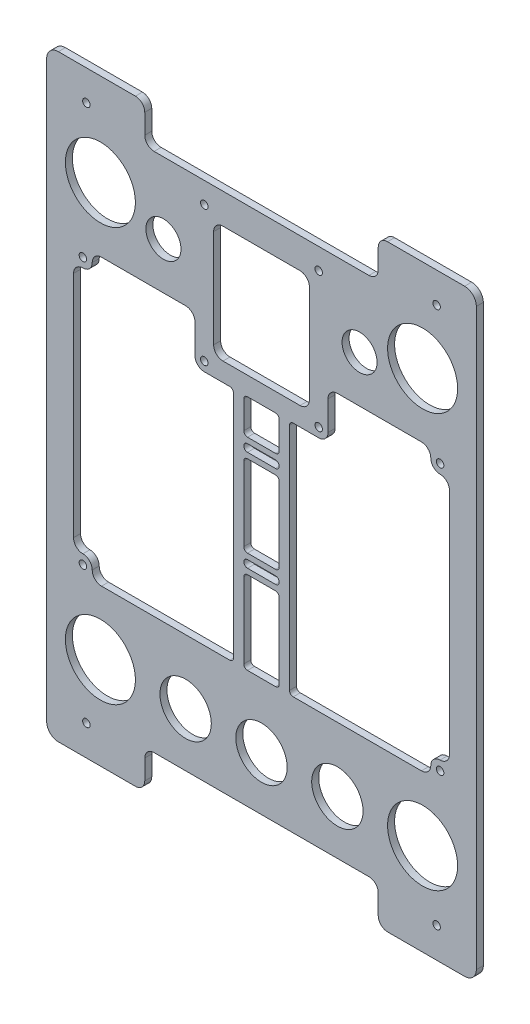
from build123d import *

# Parameters (mm, degrees)
MODEL_R             = 1.6
MODEL_R_2           = 15
MODEL_R_3           = 11
MODEL_R_4           = 7.5
BOSS_EXTRUDE1_DEPTH = 1.5


with BuildPart() as part:
    # Model → Boss-Extrude1 (new, symmetric)
    with BuildSketch(Plane.XY):
        with BuildLine():
            Line((-87, -128), (-54, -128))
            ThreePointArc((-54, -128), (-51.171572875, -126.828427125), (-50, -124))
            Line((-50, -124), (-50, -115.5))
            ThreePointArc((-50, -115.5), (-48.828427125, -112.671572875), (-46, -111.5))
            Line((-46, -111.5), (46, -111.5))
            ThreePointArc((46, -111.5), (48.828427125, -112.671572875), (50, -115.5))
            Line((50, -115.5), (50, -124))
            ThreePointArc((50, -124), (51.171572875, -126.828427125), (54, -128))
            Line((54, -128), (87, -128))
            ThreePointArc((87, -128), (90.535533906, -126.535533906), (92, -123))
            Line((92, -123), (92, 123))
            ThreePointArc((92, 123), (90.535533906, 126.535533906), (87, 128))
            Line((87, 128), (54, 128))
            ThreePointArc((54, 128), (51.171572875, 126.828427125), (50, 124))
            Line((50, 124), (50, 115.5))
            ThreePointArc((50, 115.5), (48.828427125, 112.671572875), (46, 111.5))
            Line((46, 111.5), (-46, 111.5))
            ThreePointArc((-46, 111.5), (-48.828427125, 112.671572875), (-50, 115.5))
            Line((-50, 115.5), (-50, 124))
            ThreePointArc((-50, 124), (-51.171572875, 126.828427125), (-54, 128))
            Line((-54, 128), (-87, 128))
            ThreePointArc((-87, 128), (-90.535533906, 126.535533906), (-92, 123))
            Line((-92, 123), (-92, -123))
            ThreePointArc((-92, -123), (-90.535533906, -126.535533906), (-87, -128))
        make_face()
        with Locations((-75, 115)):
            Circle(MODEL_R, mode=Mode.SUBTRACT)
        with Locations((75, 115)):
            Circle(MODEL_R, mode=Mode.SUBTRACT)
        with Locations((-75, -115)):
            Circle(MODEL_R, mode=Mode.SUBTRACT)
        with Locations((75, -115)):
            Circle(MODEL_R, mode=Mode.SUBTRACT)
        with Locations((-69, 88.5)):
            Circle(MODEL_R_2, mode=Mode.SUBTRACT)
        with Locations((69, 88.5)):
            Circle(MODEL_R_2, mode=Mode.SUBTRACT)
        with Locations((-69, -88.5)):
            Circle(MODEL_R_2, mode=Mode.SUBTRACT)
        with Locations((69, -88.5)):
            Circle(MODEL_R_2, mode=Mode.SUBTRACT)
        with Locations((-24.5, 44.5)):
            Circle(MODEL_R, mode=Mode.SUBTRACT)
        with Locations((24.5, 44.5)):
            Circle(MODEL_R, mode=Mode.SUBTRACT)
        with Locations((-24.5, 102.5)):
            Circle(MODEL_R, mode=Mode.SUBTRACT)
        with Locations((24.5, 102.5)):
            Circle(MODEL_R, mode=Mode.SUBTRACT)
        with Locations((0, -88.5)):
            Circle(MODEL_R_3, mode=Mode.SUBTRACT)
        with Locations((-76.5, -57)):
            Circle(MODEL_R, mode=Mode.SUBTRACT)
        with Locations((-76.5, 57)):
            Circle(MODEL_R, mode=Mode.SUBTRACT)
        with Locations((76.5, -57)):
            Circle(MODEL_R, mode=Mode.SUBTRACT)
        with Locations((76.5, 57)):
            Circle(MODEL_R, mode=Mode.SUBTRACT)
        with Locations((-32.5, -88.5)):
            Circle(MODEL_R_3, mode=Mode.SUBTRACT)
        with Locations((32.5, -88.5)):
            Circle(MODEL_R_3, mode=Mode.SUBTRACT)
        with Locations((-42, 81)):
            Circle(MODEL_R_4, mode=Mode.SUBTRACT)
        with Locations((42, 81)):
            Circle(MODEL_R_4, mode=Mode.SUBTRACT)
        with BuildLine():
            Line((-24.5, 40.5), (-13.6, 40.5))
            ThreePointArc((-13.6, 40.5), (-12.46862915, 40.03137085), (-12, 38.9))
            Line((-12, 38.9), (-12, -59.4))
            ThreePointArc((-12, -59.4), (-12.46862915, -60.53137085), (-13.6, -61))
            Line((-13.6, -61), (-68.5, -61))
            ThreePointArc((-68.5, -61), (-71.328427125, -59.828427125), (-72.5, -57))
            ThreePointArc((-72.5, -57), (-73.671572875, -54.171572875), (-76.5, -53))
            ThreePointArc((-76.5, -53), (-79.328427125, -51.828427125), (-80.5, -49))
            Line((-80.5, -49), (-80.5, 49))
            ThreePointArc((-80.5, 49), (-79.328427125, 51.828427125), (-76.5, 53))
            ThreePointArc((-76.5, 53), (-73.671572875, 54.171572875), (-72.5, 57))
            ThreePointArc((-72.5, 57), (-71.328427125, 59.828427125), (-68.5, 61))
            Line((-68.5, 61), (-32.5, 61))
            ThreePointArc((-32.5, 61), (-29.671572875, 59.828427125), (-28.5, 57))
            Line((-28.5, 57), (-28.5, 44.5))
            ThreePointArc((-28.5, 44.5), (-27.328427125, 41.671572875), (-24.5, 40.5))
        make_face(mode=Mode.SUBTRACT)
        with BuildLine():
            Line((28.5, 44.5), (28.5, 57))
            ThreePointArc((28.5, 57), (29.671572875, 59.828427125), (32.5, 61))
            Line((32.5, 61), (68.5, 61))
            ThreePointArc((68.5, 61), (71.328427125, 59.828427125), (72.5, 57))
            ThreePointArc((72.5, 57), (73.671572875, 54.171572875), (76.5, 53))
            ThreePointArc((76.5, 53), (79.328427125, 51.828427125), (80.5, 49))
            Line((80.5, 49), (80.5, -49))
            ThreePointArc((80.5, -49), (79.328427125, -51.828427125), (76.5, -53))
            ThreePointArc((76.5, -53), (73.671572875, -54.171572875), (72.5, -57))
            ThreePointArc((72.5, -57), (71.328427125, -59.828427125), (68.5, -61))
            Line((68.5, -61), (13.6, -61))
            ThreePointArc((13.6, -61), (12.46862915, -60.53137085), (12, -59.4))
            Line((12, -59.4), (12, 38.9))
            ThreePointArc((12, 38.9), (12.46862915, 40.03137085), (13.6, 40.5))
            Line((13.6, 40.5), (24.5, 40.5))
            ThreePointArc((24.5, 40.5), (27.328427125, 41.671572875), (28.5, 44.5))
        make_face(mode=Mode.SUBTRACT)
        with BuildLine():
            Line((-16.5, 48.5), (16.5, 48.5))
            ThreePointArc((16.5, 48.5), (19.328427125, 49.671572875), (20.5, 52.5))
            Line((20.5, 52.5), (20.5, 94.5))
            ThreePointArc((20.5, 94.5), (19.328427125, 97.328427125), (16.5, 98.5))
            Line((16.5, 98.5), (-16.5, 98.5))
            ThreePointArc((-16.5, 98.5), (-19.328427125, 97.328427125), (-20.5, 94.5))
            Line((-20.5, 94.5), (-20.5, 52.5))
            ThreePointArc((-20.5, 52.5), (-19.328427125, 49.671572875), (-16.5, 48.5))
        make_face(mode=Mode.SUBTRACT)
        with BuildLine():
            Line((-6, 23.1), (6, 23.1))
            ThreePointArc((6, 23.1), (7.6, 21.5), (6, 19.9))
            Line((6, 19.9), (-6, 19.9))
            ThreePointArc((-6, 19.9), (-7.6, 21.5), (-6, 23.1))
        make_face(mode=Mode.SUBTRACT)
        with BuildLine():
            Line((-6, -19.9), (6, -19.9))
            ThreePointArc((6, -19.9), (7.6, -21.5), (6, -23.1))
            Line((6, -23.1), (-6, -23.1))
            ThreePointArc((-6, -23.1), (-7.6, -21.5), (-6, -19.9))
        make_face(mode=Mode.SUBTRACT)
        with BuildLine():
            Line((-6, 17.5), (6, 17.5))
            ThreePointArc((6, 17.5), (7.13137085, 17.03137085), (7.6, 15.9))
            Line((7.6, 15.9), (7.6, -15.9))
            ThreePointArc((7.6, -15.9), (7.13137085, -17.03137085), (6, -17.5))
            Line((6, -17.5), (-6, -17.5))
            ThreePointArc((-6, -17.5), (-7.13137085, -17.03137085), (-7.6, -15.9))
            Line((-7.6, -15.9), (-7.6, 15.9))
            ThreePointArc((-7.6, 15.9), (-7.13137085, 17.03137085), (-6, 17.5))
        make_face(mode=Mode.SUBTRACT)
        with BuildLine():
            Line((-6, 25.5), (6, 25.5))
            ThreePointArc((6, 25.5), (7.13137085, 25.96862915), (7.6, 27.1))
            Line((7.6, 27.1), (7.6, 38.9))
            ThreePointArc((7.6, 38.9), (7.13137085, 40.03137085), (6, 40.5))
            Line((6, 40.5), (-6, 40.5))
            ThreePointArc((-6, 40.5), (-7.13137085, 40.03137085), (-7.6, 38.9))
            Line((-7.6, 38.9), (-7.6, 27.1))
            ThreePointArc((-7.6, 27.1), (-7.13137085, 25.96862915), (-6, 25.5))
        make_face(mode=Mode.SUBTRACT)
        with BuildLine():
            Line((-6, -25.5), (6, -25.5))
            ThreePointArc((6, -25.5), (7.13137085, -25.96862915), (7.6, -27.1))
            Line((7.6, -27.1), (7.6, -59.4))
            ThreePointArc((7.6, -59.4), (7.13137085, -60.53137085), (6, -61))
            Line((6, -61), (-6, -61))
            ThreePointArc((-6, -61), (-7.13137085, -60.53137085), (-7.6, -59.4))
            Line((-7.6, -59.4), (-7.6, -27.1))
            ThreePointArc((-7.6, -27.1), (-7.13137085, -25.96862915), (-6, -25.5))
        make_face(mode=Mode.SUBTRACT)
    extrude(amount=BOSS_EXTRUDE1_DEPTH, both=True)


solid = part.part
